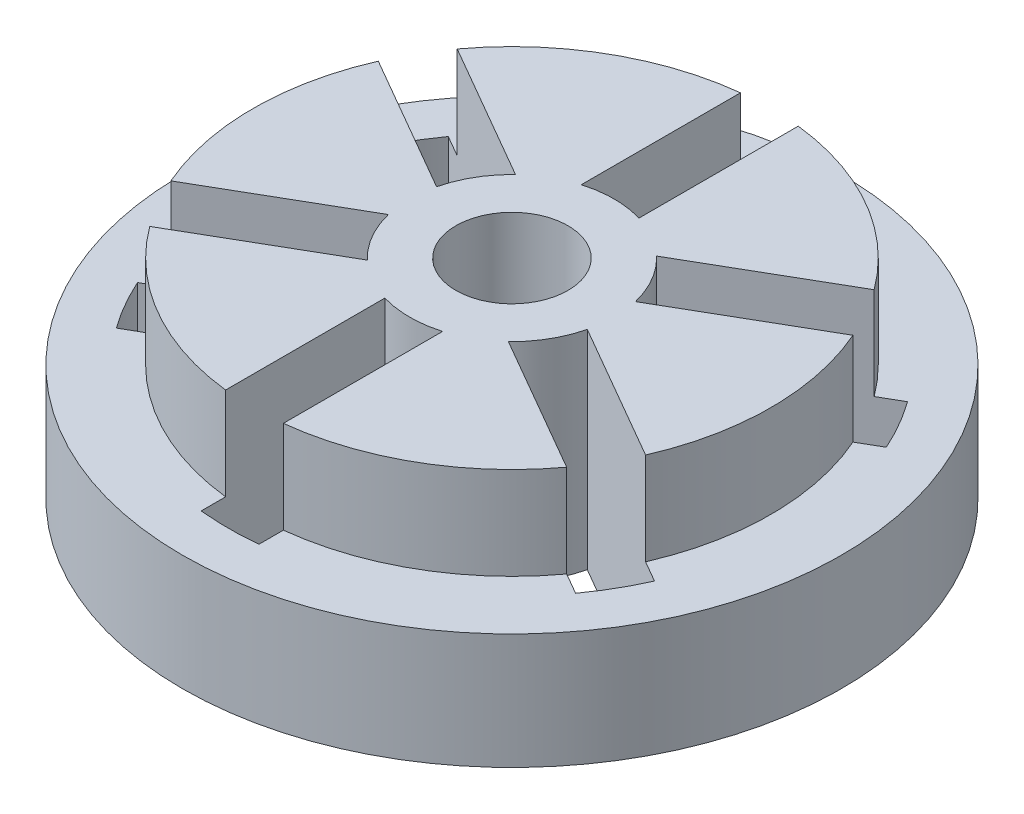
from build123d import *

# Parameters (mm, degrees)
SKETCH1_R           = 28.5
BOSS_EXTRUDE1_DEPTH = 10
SKETCH2_R           = 22.4
BOSS_EXTRUDE2_DEPTH = 8
SKETCH3_R           = 4.85
CUT_EXTRUDE1_DEPTH  = 45.141816909
CUT_EXTRUDE2_DEPTH  = 45.141816909
CIRPATTERN1_COUNT   = 6


with BuildPart() as part:
    # Sketch1 → Boss-Extrude1 (new body)
    with BuildSketch(Plane(origin=(0, 0, 0), x_dir=(1, 0, 0), z_dir=(0, 1, 0))):
        with Locations(Location((0, 0, 0), (0, 0, 270))):
            Circle(SKETCH1_R)
    extrude(amount=BOSS_EXTRUDE1_DEPTH)

    # Sketch2 → Boss-Extrude2 (add)
    with BuildSketch(Plane(origin=(0, 10, 0), x_dir=(1, 0, 0), z_dir=(0, 1, 0))):
        with Locations(Location((0, 0, 0), (0, 0, 270))):
            Circle(SKETCH2_R)
    extrude(amount=BOSS_EXTRUDE2_DEPTH)

    # Sketch3 → Cut-Extrude1 (cut, through all)
    with BuildSketch(Plane(origin=(0, 18, 0), x_dir=(1, 0, 0), z_dir=(0, 1, 0))):
        with Locations(Location((0, 0, 0), (0, 0, 270))):
            Circle(SKETCH3_R)
    extrude(amount=-CUT_EXTRUDE1_DEPTH, mode=Mode.SUBTRACT)

    # Sketch9 → Cut-Extrude2 (cut, through all)
    with BuildSketch(Plane.XZ):
        with BuildLine():
            Line((0, 24.5), (0, 8.85))
            ThreePointArc((0, 8.85), (1.260616548, 8.759757184), (2.495524262, 8.490869134))
            Line((2.495524262, 8.490869134), (2.495524262, 24.372573903))
            ThreePointArc((2.495524262, 24.372573903), (1.249387725, 24.468122738), (0, 24.5))
        make_face()
        with BuildLine():
            ThreePointArc((-2.5, 8.489552403), (-1.26292542, 8.759424603), (0, 8.85))
            Line((0, 8.85), (0, 24.5))
            ThreePointArc((0, 24.5), (-1.251634383, 24.468007916), (-2.5, 24.372115214))
            Line((-2.5, 24.372115214), (-2.5, 8.489552403))
        make_face()
    cut_extrude2 = extrude(amount=-CUT_EXTRUDE2_DEPTH, mode=Mode.SUBTRACT)

    # CirPattern1: Cut-Extrude2 ×6 about axis
    cirpattern1_axis = Axis((0, 0, 0), (0, 1, 0))
    for i in range(1, CIRPATTERN1_COUNT):
        add(cut_extrude2.rotate(cirpattern1_axis, i * 360 / CIRPATTERN1_COUNT), mode=Mode.SUBTRACT)


solid = part.part
